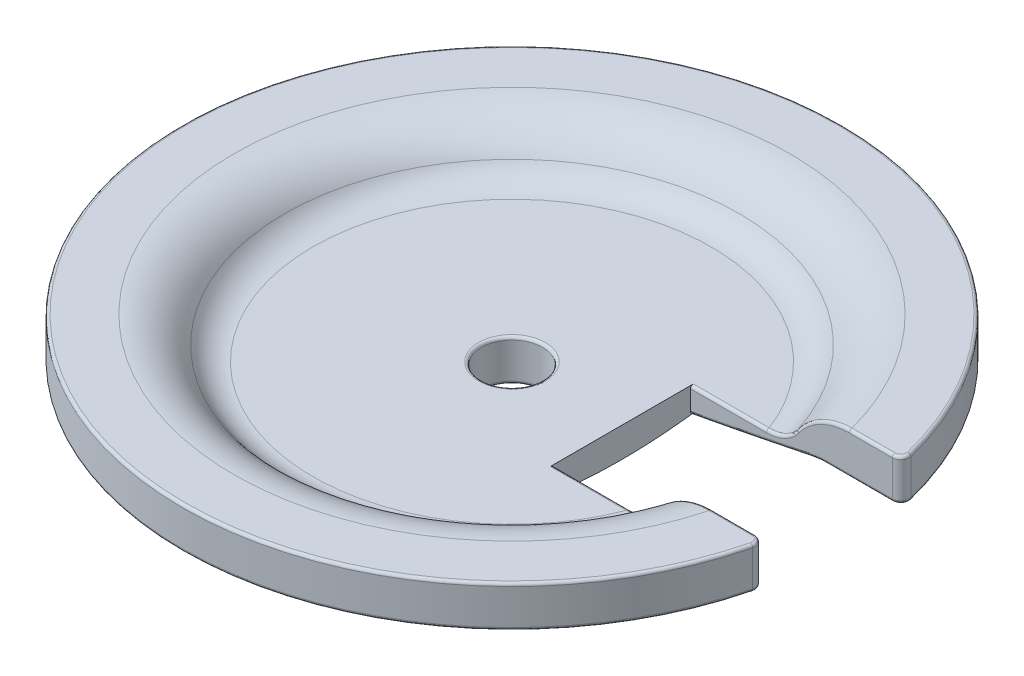
from build123d import *

# Parameters (mm, degrees)
SKETCH2_W          = 50.416666667
SKETCH2_H          = 20.166666666
CUT_EXTRUDE1_DEPTH = 70.509208041
FILLET1_R          = 1.25
FILLET2_R          = 0.42


with BuildPart() as part:
    # Sketch1 → Revolve1 (revolve)
    with BuildSketch(Plane.XY, mode=Mode.PRIVATE) as revolve1_sk:
        with BuildLine():
            Line((4.4925, 0), (7.01414, 0))
            ThreePointArc((7.01414, 0), (8.28882394, 0.067328607), (9.54932231, 0.268565148))
            Line((9.54932231, 0.268565148), (35.277317687, 5.781434852))
            ThreePointArc((35.277317687, 5.781434852), (36.537816057, 5.982671393), (37.812499997, 6.05))
            Line((37.812499997, 6.05), (48.4, 6.05))
            Line((48.4, 6.05), (48.4, 12.1))
            Line((48.4, 12.1), (40.825306818, 12.1))
            ThreePointArc((40.825306818, 12.1), (36.624278082, 11.069065053), (33.377736913, 8.210492027))
            ThreePointArc((33.377736913, 8.210492027), (31.574391514, 6.622649998), (29.240860088, 6.05))
            Line((29.240860088, 6.05), (4.4925, 6.05))
            Line((4.4925, 6.05), (4.4925, 0))
        make_face()
    revolve(revolve1_sk.sketch.rotate(Axis((0, 0, 0), (0, 1, 0)), 90), axis=Axis((0, 0, 0), (0, 1, 0)))

    # Sketch2 → Cut-Extrude1 (cut, through all)
    with BuildSketch(Plane(origin=(0, 12.1, 0), x_dir=(1, 0, 0), z_dir=(0, 1, 0))):
        with Locations((41.341666666, 0)):
            Rectangle(SKETCH2_W, SKETCH2_H)
    extrude(amount=-CUT_EXTRUDE1_DEPTH, mode=Mode.SUBTRACT)

    # Fillet1
    fillet1_edges = [part.edges().sort_by_distance(p)[0] for p in [
        (47.33800153, 9.075, 10.083333333),
        (47.33800153, 9.075, -10.083333333),
    ]]
    fillet(fillet1_edges, radius=FILLET1_R)

    # Fillet2
    fillet2_edges = [part.edges().sort_by_distance(p)[0] for p in [
        (0, 0, 4.4925),
        (21.79031676, 6.05, -10.083333333),
        (21.79031676, 6.05, 10.083333333),
        (42.664069552, 12.1, 10.083333333),
        (35.117609744, 5.982538133, 10.083333333),
        (24.97845263, 3.994291218, 10.083333333),
        (29.892466077, 6.608613789, 10.083333333),
        (41.105458839, 6.05, 10.083333333),
        (24.97845263, 3.994291218, -10.083333333),
        (35.117609744, 5.982538133, -10.083333333),
        (41.105458839, 6.05, -10.083333333),
        (41.105458839, 6.05, -10.083333333),
        (29.892466077, 6.608613789, -10.083333333),
        (41.105458839, 6.05, 10.083333333),
        (-48.4, 6.05, 0),
        (46.752049812, 6.05, -10.562967968),
        (46.752049812, 6.05, 10.562967968),
        (-48.4, 12.1, 0),
        (42.664069552, 12.1, -10.083333333),
        (46.752049812, 12.1, -10.562967968),
        (46.752049812, 12.1, 10.562967968),
        (0, 6.05, 4.4925),
    ]]
    fillet(fillet2_edges, radius=FILLET2_R)


solid = part.part
